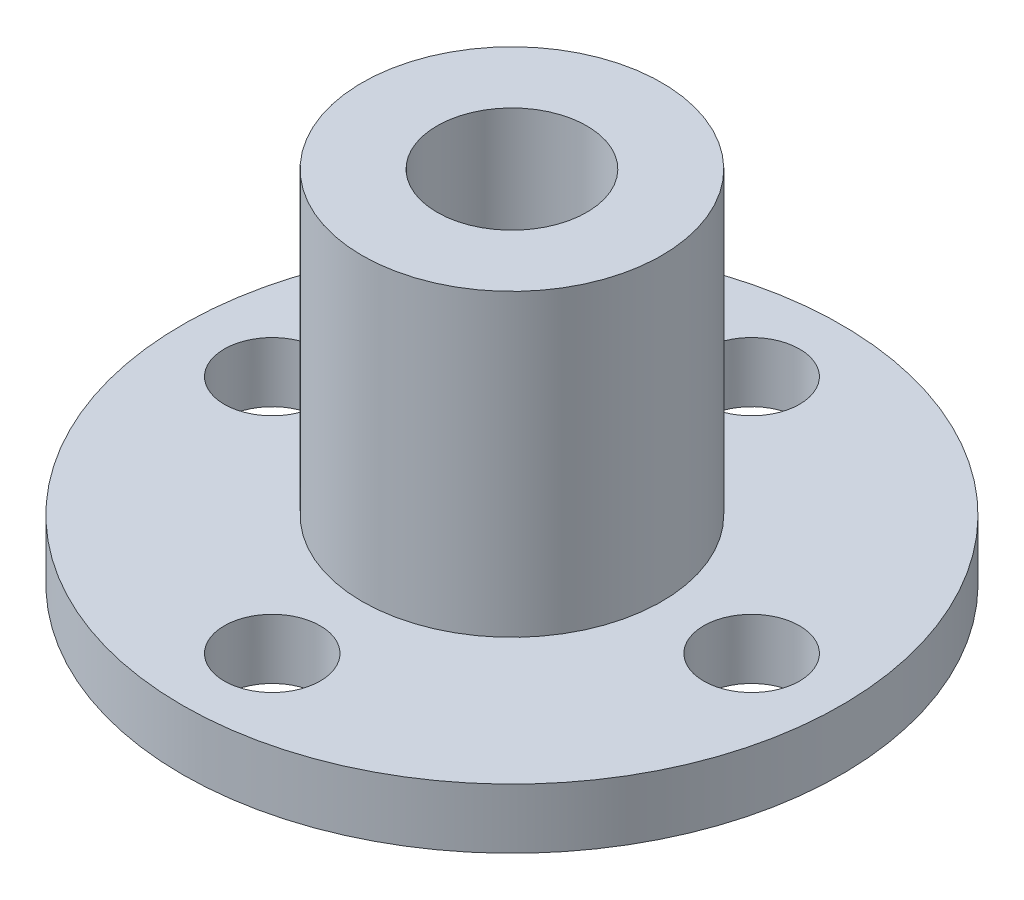
from build123d import *

# Parameters (mm, degrees)
SKETCH1_R           = 11
BOSS_EXTRUDE1_DEPTH = 2
SKETCH3_R           = 5
BOSS_EXTRUDE2_DEPTH = 10
SKETCH4_R           = 2.5
CUT_EXTRUDE1_DEPTH  = 20.646882704
SKETCH5_R           = 1.6
CUT_EXTRUDE2_DEPTH  = 20.646882704


with BuildPart() as part:
    # Sketch1 → Boss-Extrude1 (new body)
    with BuildSketch(Plane(origin=(0, 0, 0), x_dir=(1, 0, 0), z_dir=(0, 1, 0))):
        with Locations(Location((0, 0, 0), (0, 0, 270))):
            Circle(SKETCH1_R)
    extrude(amount=BOSS_EXTRUDE1_DEPTH)

    # Sketch3 → Boss-Extrude2 (add)
    with BuildSketch(Plane(origin=(0, 2, 0), x_dir=(1, 0, 0), z_dir=(0, 1, 0))):
        with Locations(Location((0, 0, 0), (0, 0, 270))):
            Circle(SKETCH3_R)
    extrude(amount=BOSS_EXTRUDE2_DEPTH)

    # Sketch4 → Cut-Extrude1 (cut, through all)
    with BuildSketch(Plane(origin=(0, 12, 0), x_dir=(1, 0, 0), z_dir=(0, 1, 0))):
        with Locations(Location((0, 0, 0), (0, 0, 270))):
            Circle(SKETCH4_R)
    extrude(amount=-CUT_EXTRUDE1_DEPTH, mode=Mode.SUBTRACT)

    # Sketch5 → Cut-Extrude2 (cut, through all)
    with BuildSketch(Plane.XZ):
        with Locations(Location((0, 8, 0), (0, 0, 270))):
            Circle(SKETCH5_R)
        with Locations(Location((-8, 0, 0), (0, 0, 270))):
            Circle(SKETCH5_R)
        with Locations(Location((0, -8, 0), (0, 0, 270))):
            Circle(SKETCH5_R)
        with Locations(Location((8, 0, 0), (0, 0, 270))):
            Circle(SKETCH5_R)
    extrude(amount=-CUT_EXTRUDE2_DEPTH, mode=Mode.SUBTRACT)


solid = part.part
